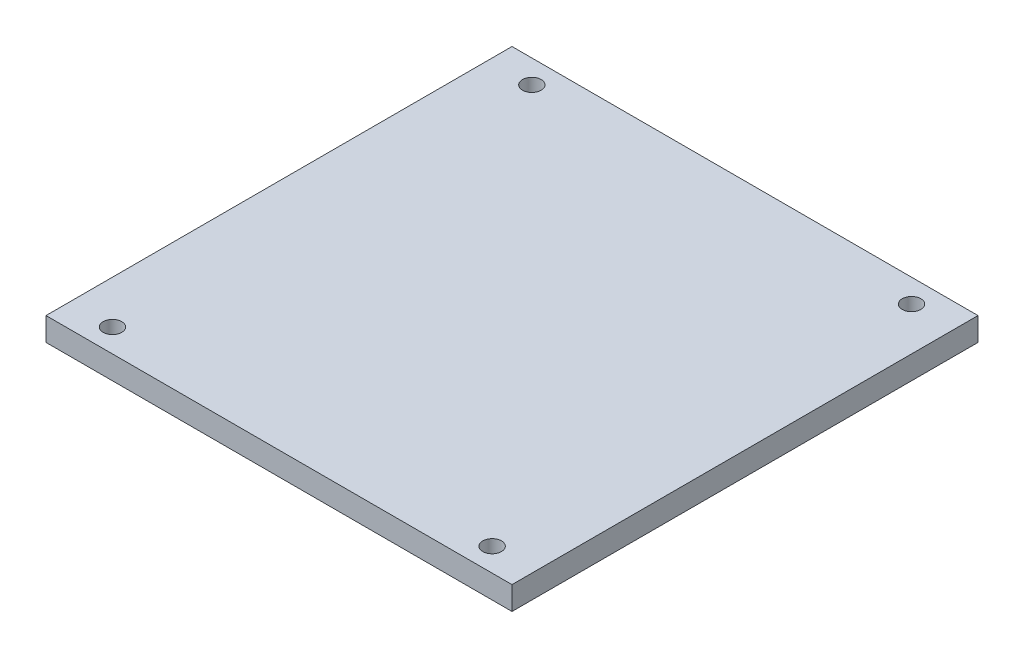
from build123d import *

# Parameters (mm, degrees)
SKETCH1_W           = 127
SKETCH1_H           = 127
BOSS_EXTRUDE1_DEPTH = 6.35
SKETCH3_R           = 2.54
CUT_EXTRUDE2_DEPTH  = 9.525


with BuildPart() as part:
    # Sketch1 → Boss-Extrude1 (new body)
    with BuildSketch(Plane(origin=(0, 0, 0), x_dir=(1, 0, 0), z_dir=(0, 1, 0))):
        Rectangle(SKETCH1_W, SKETCH1_H)
    extrude(amount=BOSS_EXTRUDE1_DEPTH)

    # Sketch3 → Cut-Extrude2 (cut)
    with BuildSketch(Plane(origin=(0, 6.35, 0), x_dir=(1, 0, 0), z_dir=(0, 1, 0))):
        with Locations(Location((-51.738148447, 57.15, 0), (0, 0, 270))):
            Circle(SKETCH3_R)
        with Locations(Location((51.738148447, 57.15, 0), (0, 0, 270))):
            Circle(SKETCH3_R)
        with Locations(Location((-51.738148447, -57.15, 0), (0, 0, 270))):
            Circle(SKETCH3_R)
        with Locations(Location((51.738148447, -57.15, 0), (0, 0, 270))):
            Circle(SKETCH3_R)
    extrude(amount=-CUT_EXTRUDE2_DEPTH, mode=Mode.SUBTRACT)


solid = part.part
